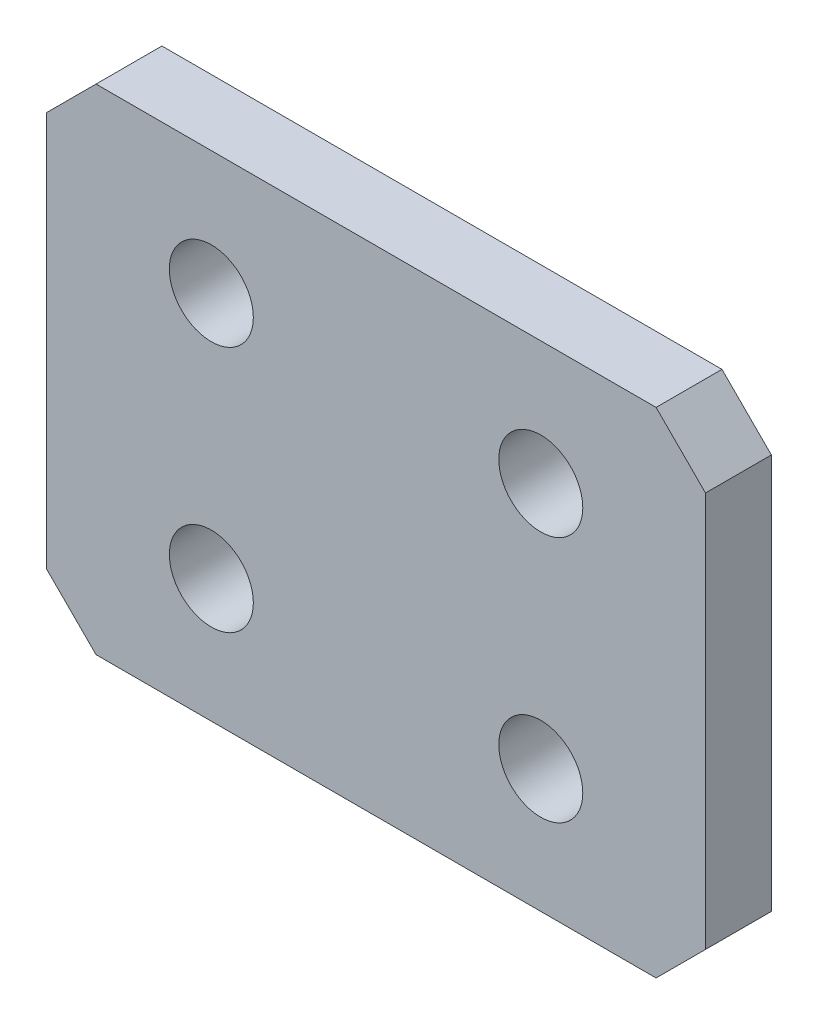
from build123d import *

# Parameters (mm, degrees)
SKETCH1_W           = 40
SKETCH1_H           = 30
BOSS_EXTRUDE1_DEPTH = 4
SKETCH3_R           = 2.55
CUT_EXTRUDE2_DEPTH  = 26.317977802
CHAMFER1_SIZE       = 3
LPATTERN1_COUNT     = 2
LPATTERN1_PITCH     = 20


with BuildPart() as part:
    # Sketch1 → Boss-Extrude1 (new body)
    with BuildSketch(Plane.XY):
        Rectangle(SKETCH1_W, SKETCH1_H)
    extrude(amount=BOSS_EXTRUDE1_DEPTH)

    # Sketch3 → Cut-Extrude2 (cut, through all)
    with BuildSketch(Plane.XY.offset(4)):
        with Locations((10, 7.5)):
            Circle(SKETCH3_R)
        with Locations((10, -7.5)):
            Circle(SKETCH3_R)
    cut_extrude2 = extrude(amount=-CUT_EXTRUDE2_DEPTH, mode=Mode.SUBTRACT)

    # Chamfer1
    chamfer1_edges = [part.edges().sort_by_distance(p)[0] for p in [
        (20, -15, 2),
        (-20, -15, 2),
        (-20, 15, 2),
        (20, 15, 2),
    ]]
    chamfer(chamfer1_edges, length=CHAMFER1_SIZE)

    # LPattern1: Cut-Extrude2 ×2
    with Locations(*[(-i * LPATTERN1_PITCH, 0, 0) for i in range(1, LPATTERN1_COUNT)]):
        add(cut_extrude2, mode=Mode.SUBTRACT)


solid = part.part
